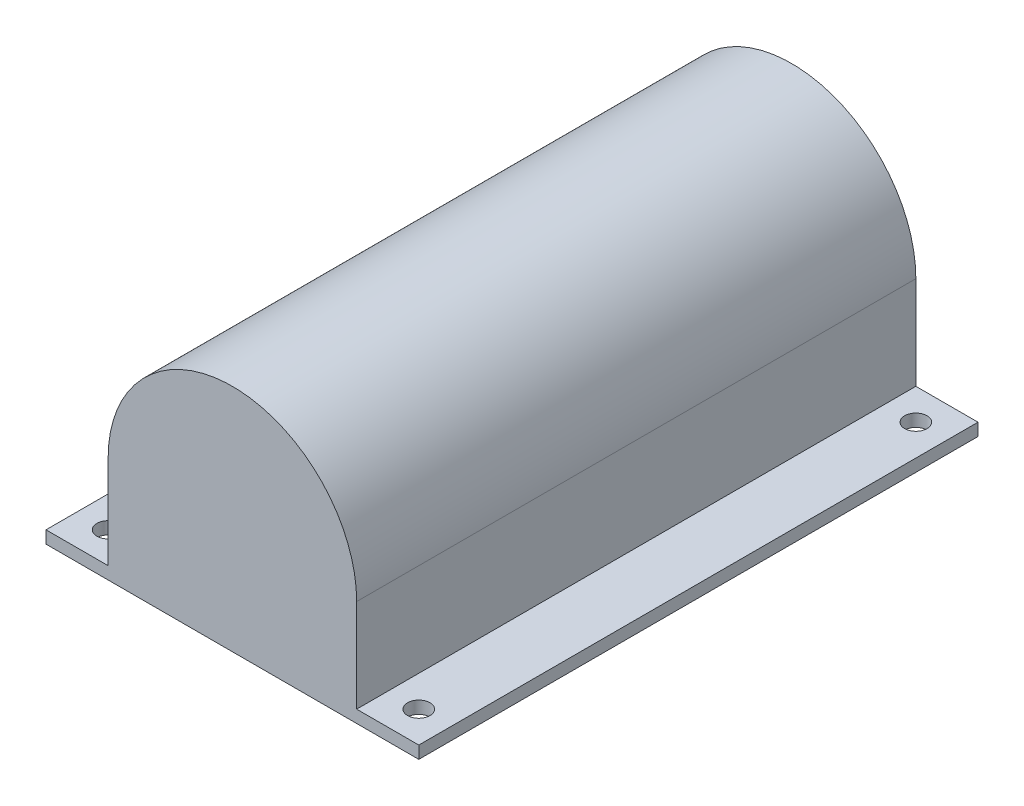
from build123d import *

# Parameters (mm, degrees)
BOSS_EXTRUDE2_DEPTH = 114.3
SKETCH2_R           = 2.286
CUT_EXTRUDE1_DEPTH  = 145.383975911
CUT_EXTRUDE2_DEPTH  = 114.046
SKETCH5_R           = 2.499999953
CUT_EXTRUDE3_DEPTH  = 146.186053394
SKETCH7_R           = 3.175
CUT_EXTRUDE4_DEPTH  = 145.383975911


with BuildPart() as part:
    # Sketch1 → Boss-Extrude2 (new body)
    with BuildSketch(Plane.XY):
        with BuildLine():
            Line((0, 0), (76.2, 0))
            Line((76.2, 0), (76.2, 2.54))
            Line((76.2, 2.54), (63.5, 2.54))
            Line((63.5, 2.54), (63.5, 21.59))
            ThreePointArc((63.5, 21.59), (38.1, 46.99), (12.7, 21.59))
            Line((12.7, 21.59), (12.7, 2.54))
            Line((12.7, 2.54), (0, 2.54))
            Line((0, 2.54), (0, 0))
        make_face()
    extrude(amount=BOSS_EXTRUDE2_DEPTH)

    # Sketch2 → Cut-Extrude1 (cut, through all)
    with BuildSketch(Plane(origin=(0, 2.54, 0), x_dir=(1, 0, 0), z_dir=(0, 1, 0))):
        with Locations(Location((6.35, -6.35, 0), (0, 0, 270))):
            Circle(SKETCH2_R)
        with Locations(Location((69.85, -6.35, 0), (0, 0, 270))):
            Circle(SKETCH2_R)
        with Locations(Location((69.85, -107.95, 0), (0, 0, 270))):
            Circle(SKETCH2_R)
        with Locations(Location((6.35, -107.95, 0), (0, 0, 270))):
            Circle(SKETCH2_R)
    extrude(amount=-CUT_EXTRUDE1_DEPTH, mode=Mode.SUBTRACT)

    # Sketch4 → Cut-Extrude2 (cut)
    with BuildSketch(Plane(origin=(0, 0, 0), x_dir=(-1, 0, 0), z_dir=(0, 0, -1))):
        with BuildLine():
            Line((-60.96, 2.54), (-15.24, 2.54))
            Line((-15.24, 2.54), (-15.24, 21.59))
            ThreePointArc((-15.24, 21.59), (-38.1, 44.45), (-60.96, 21.59))
            Line((-60.96, 21.59), (-60.96, 2.54))
        make_face()
    extrude(amount=-CUT_EXTRUDE2_DEPTH, mode=Mode.SUBTRACT)

    # Sketch5 → Cut-Extrude3 (cut, through all)
    with BuildSketch(Plane(origin=(0, 0, 0), x_dir=(-1, 0, 0), z_dir=(0, -1, 0))):
        with Locations(Location((-6.35, -88.9, 0), (0, 0, 90))):
            Circle(SKETCH5_R)
        with Locations(Location((-6.35, -78.74, 0), (0, 0, 90))):
            Circle(SKETCH5_R)
        with Locations(Location((-6.35, -68.58, 0), (0, 0, 90))):
            Circle(SKETCH5_R)
        with Locations(Location((-6.35, -58.42, 0), (0, 0, 90))):
            Circle(SKETCH5_R)
    extrude(amount=-CUT_EXTRUDE3_DEPTH, mode=Mode.SUBTRACT)

    # Sketch7 → Cut-Extrude4 (cut, through all)
    with BuildSketch(Plane(origin=(0, 2.54, 0), x_dir=(1, 0, 0), z_dir=(0, 1, 0))):
        with Locations(Location((6.35, -25.4, 0), (0, 0, 270))):
            Circle(SKETCH7_R)
    extrude(amount=-CUT_EXTRUDE4_DEPTH, mode=Mode.SUBTRACT)


solid = part.part
